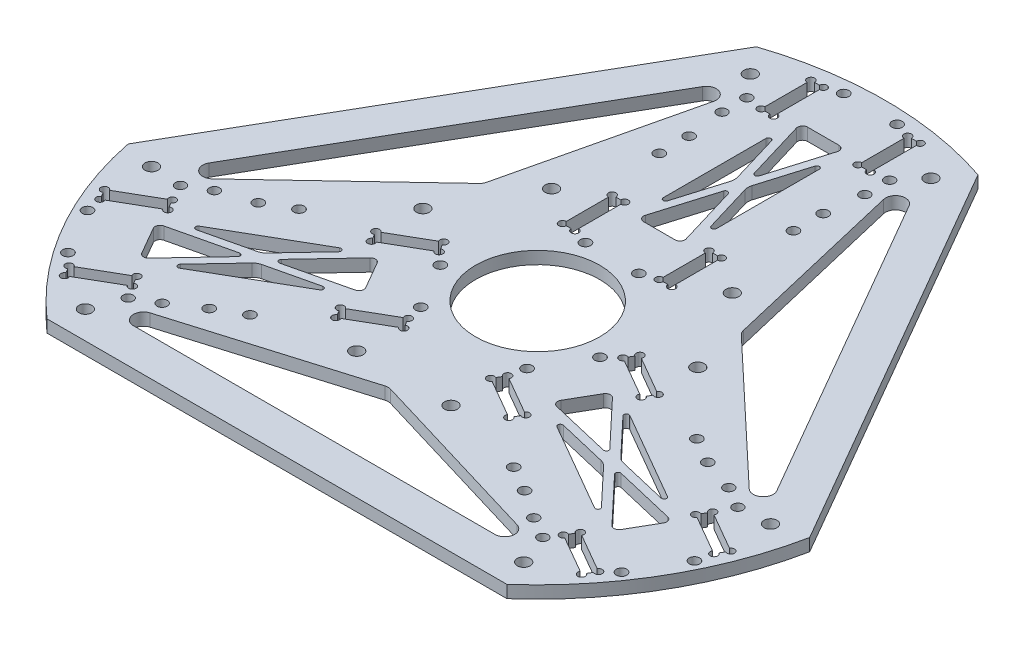
from build123d import *

# Parameters (mm, degrees)
EXTRUDE_1_DEPTH          = 5
SKETCH_2_R               = 2.1
SKETCH_2_R_2             = 2.6
SKETCH_2_W               = 5
SKETCH_2_H               = 20
CUT_EXTRUDE_1_DEPTH      = 10
PATTERN_CIRCULAR_1_COUNT = 3
CUT_EXTRUDE_2_DEPTH      = 10
CUT_EXTRUDE_3_DEPTH      = 10
SKETCH_5_R               = 25
CUT_EXTRUDE_4_DEPTH      = 10
SKETCH_6_R               = 1.5
CUT_EXTRUDE_5_DEPTH      = 229.487776915
CUT_EXTRUDE_6_DEPTH      = 229.487776915
SKETCH_8_R               = 2.05
CUT_EXTRUDE_7_DEPTH      = 10


with BuildPart() as part:
    # 草图1 → 凸台-拉伸1 (new body)
    with BuildSketch(Plane(origin=(0, 0, 0), x_dir=(1, 0, 0), z_dir=(0, 1, 0))):
        with BuildLine():
            Line((-34.641016151, 150), (-147.224318643, -45))
            ThreePointArc((-147.224318643, -45), (-147.224318643, -85), (-112.583302492, -105))
            Line((-112.583302492, -105), (112.583302492, -105))
            ThreePointArc((112.583302492, -105), (147.224318643, -85), (147.224318643, -45))
            Line((147.224318643, -45), (34.641016151, 150))
            ThreePointArc((34.641016151, 150), (0, 170), (-34.641016151, 150))
        make_face()
    extrude(amount=EXTRUDE_1_DEPTH)

    # 草图2 → 切除-拉伸1 (cut)
    with BuildSketch(Plane(origin=(0, 5, 0), x_dir=(1, 0, 0), z_dir=(0, 1, 0))):
        with Locations(Location((-10.75, 30, 0), (0, 0, 270))):
            Circle(SKETCH_2_R)
        with Locations(Location((-10.75, 134, 0), (0, 0, 270))):
            Circle(SKETCH_2_R)
        with Locations(Location((10.75, 30, 0), (0, 0, 270))):
            Circle(SKETCH_2_R)
        with Locations(Location((10.75, 134, 0), (0, 0, 270))):
            Circle(SKETCH_2_R)
        with Locations(Location((-36.38, 42, 0), (0, 0, 270))):
            Circle(SKETCH_2_R_2)
        with Locations(Location((-36.38, 122, 0), (0, 0, 270))):
            Circle(SKETCH_2_R_2)
        with Locations(Location((36.38, 122, 0), (0, 0, 270))):
            Circle(SKETCH_2_R_2)
        with Locations(Location((36.38, 42, 0), (0, 0, 270))):
            Circle(SKETCH_2_R_2)
        with Locations(Location((-27, 88, 0), (0, 0, 270))):
            Circle(SKETCH_2_R)
        with Locations(Location((-27, 76, 0), (0, 0, 270))):
            Circle(SKETCH_2_R)
        with Locations(Location((27, 76, 0), (0, 0, 270))):
            Circle(SKETCH_2_R)
        with Locations(Location((27, 88, 0), (0, 0, 270))):
            Circle(SKETCH_2_R)
        with Locations((-19.5, 42)):
            Rectangle(SKETCH_2_W, SKETCH_2_H)
        with Locations((-19.5, 122)):
            Rectangle(SKETCH_2_W, SKETCH_2_H)
        with Locations((19.5, 42)):
            Rectangle(SKETCH_2_W, SKETCH_2_H)
        with Locations((19.5, 122)):
            Rectangle(SKETCH_2_W, SKETCH_2_H)
    cut_extrude_1 = extrude(amount=-CUT_EXTRUDE_1_DEPTH, mode=Mode.SUBTRACT)

    # 阵列(圆周)1: 切除-拉伸1 ×3 about axis
    pattern_circular_1_axis = Axis((0, 0, 0.914797287), (0, 1, 0))
    for i in range(1, PATTERN_CIRCULAR_1_COUNT):
        add(cut_extrude_1.rotate(pattern_circular_1_axis, i * 360 / PATTERN_CIRCULAR_1_COUNT), mode=Mode.SUBTRACT)

    # 草图3 → 切除-拉伸2 (cut)
    with BuildSketch(Plane(origin=(0, 5, 0), x_dir=(1, 0, 0), z_dir=(0, 1, 0))):
        with BuildLine():
            Line((-72.746257988, -90), (72.746257988, -90))
            ThreePointArc((72.746257988, -90), (76.70385957, -86.580852579), (73.89564953, -82.168694859))
            Line((73.89564953, -82.168694859), (1.149391542, -60.344817463))
            ThreePointArc((1.149391542, -60.344817463), (0, -60.176122604), (-1.149391542, -60.344817463))
            Line((-1.149391542, -60.344817463), (-73.89564953, -82.168694859))
            ThreePointArc((-73.89564953, -82.168694859), (-76.70385957, -86.580852579), (-72.746257988, -90))
        make_face()
        with BuildLine():
            Line((-51.685449138, 31.167811006), (-34.212352379, 105.079857152))
            ThreePointArc((-34.212352379, 105.079857152), (-36.629288029, 109.717917245), (-41.569157347, 108.000107448))
            Line((-41.569157347, 108.000107448), (-114.315415335, -18.000107448))
            ThreePointArc((-114.315415335, -18.000107448), (-113.3331476, -23.137064667), (-108.108001909, -22.911162293))
            Line((-108.108001909, -22.911162293), (-52.834840681, 29.177006457))
            ThreePointArc((-52.834840681, 29.177006457), (-52.114050876, 30.088061302), (-51.685449138, 31.167811006))
        make_face()
        with BuildLine():
            Line((52.834840681, 29.177006457), (108.108001909, -22.911162293))
            ThreePointArc((108.108001909, -22.911162293), (113.3331476, -23.137064667), (114.315415335, -18.000107448))
            Line((114.315415335, -18.000107448), (41.569157347, 108.000107448))
            ThreePointArc((41.569157347, 108.000107448), (36.629288029, 109.717917245), (34.212352379, 105.079857152))
            Line((34.212352379, 105.079857152), (51.685449138, 31.167811006))
            ThreePointArc((51.685449138, 31.167811006), (52.114050876, 30.088061302), (52.834840681, 29.177006457))
        make_face()
    extrude(amount=-CUT_EXTRUDE_2_DEPTH, mode=Mode.SUBTRACT)

    # 草图4 → 切除-拉伸3 (cut)
    with BuildSketch(Plane(origin=(0, 5, 0), x_dir=(1, 0, 0), z_dir=(0, 1, 0))):
        with BuildLine():
            Line((-6.311938698, 115), (6.311938698, 115))
            ThreePointArc((6.311938698, 115), (7.916524555, 114.193861059), (8.227591269, 112.425304229))
            Line((8.227591269, 112.425304229), (0.957826285, 88.192754284))
            ThreePointArc((0.957826285, 88.192754284), (0, 87.48010217), (-0.957826285, 88.192754284))
            Line((-0.957826285, 88.192754284), (-8.227591269, 112.425304229))
            ThreePointArc((-8.227591269, 112.425304229), (-7.916524555, 114.193861059), (-6.311938698, 115))
        make_face()
        with BuildLine():
            Line((8.227591269, 51.574695771), (0.957826285, 75.807245716))
            ThreePointArc((0.957826285, 75.807245716), (0, 76.51989783), (-0.957826285, 75.807245716))
            Line((-0.957826285, 75.807245716), (-8.227591269, 51.574695771))
            ThreePointArc((-8.227591269, 51.574695771), (-7.916524555, 49.806138941), (-6.311938698, 49))
            Line((-6.311938698, 49), (6.311938698, 49))
            ThreePointArc((6.311938698, 49), (7.916524555, 49.806138941), (8.227591269, 51.574695771))
        make_face()
        with BuildLine():
            Line((-10.75, 102.686564497), (-10.75, 61.313435503))
            ThreePointArc((-10.75, 61.313435503), (-9.895213145, 60.324035107), (-8.792173715, 61.026087617))
            Line((-8.792173715, 61.026087617), (-2.931021828, 80.563260572))
            ThreePointArc((-2.931021828, 80.563260572), (-2.720153254, 82), (-2.931021828, 83.436739428))
            Line((-2.931021828, 83.436739428), (-8.792173715, 102.973912383))
            ThreePointArc((-8.792173715, 102.973912383), (-9.895213145, 103.675964893), (-10.75, 102.686564497))
        make_face()
        with BuildLine():
            Line((10.75, 102.686564497), (10.75, 61.313435503))
            ThreePointArc((10.75, 61.313435503), (9.895213145, 60.324035107), (8.792173715, 61.026087617))
            Line((8.792173715, 61.026087617), (2.931021828, 80.563260572))
            ThreePointArc((2.931021828, 80.563260572), (2.720153254, 82), (2.931021828, 83.436739428))
            Line((2.931021828, 83.436739428), (8.792173715, 102.973912383))
            ThreePointArc((8.792173715, 102.973912383), (9.895213145, 103.675964893), (10.75, 102.686564497))
        make_face()
        with BuildLine():
            Line((93.574110908, -43.8727104), (73.723846868, -39.180030352))
            ThreePointArc((73.723846868, -39.180030352), (72.374159738, -38.644278179), (71.235341181, -37.743290924))
            Line((71.235341181, -37.743290924), (57.246229028, -22.898798017))
            ThreePointArc((57.246229028, -22.898798017), (57.189753434, -21.592511595), (58.473992739, -21.346944661))
            Line((58.473992739, -21.346944661), (94.304173482, -42.033509158))
            ThreePointArc((94.304173482, -42.033509158), (94.733625931, -43.268476487), (93.574110908, -43.8727104))
        make_face()
        with BuildLine():
            Line((40.551201096, -32.912650936), (65.172087438, -38.733124753))
            ThreePointArc((65.172087438, -38.733124753), (66.268175416, -38.259948915), (66.129913724, -37.074120963))
            Line((66.129913724, -37.074120963), (48.778792365, -18.662044835))
            ThreePointArc((48.778792365, -18.662044835), (47.091643864, -18.047158096), (45.591214135, -19.03370074))
            Line((45.591214135, -19.03370074), (39.279275436, -29.96629926))
            ThreePointArc((39.279275436, -29.96629926), (39.17511931, -31.758980844), (40.551201096, -32.912650936))
        make_face()
        with BuildLine():
            Line((83.554173482, -60.653055339), (47.723992739, -39.966490842))
            ThreePointArc((47.723992739, -39.966490842), (47.29454029, -38.731523513), (48.454055313, -38.1272896))
            Line((48.454055313, -38.1272896), (68.304319353, -42.819969648))
            ThreePointArc((68.304319353, -42.819969648), (69.654006483, -43.355721821), (70.792825039, -44.256709076))
            Line((70.792825039, -44.256709076), (84.781937193, -59.101201983))
            ThreePointArc((84.781937193, -59.101201983), (84.838412786, -60.407488405), (83.554173482, -60.653055339))
        make_face()
        with BuildLine():
            Line((76.856078782, -43.266875247), (101.476965125, -49.087349064))
            ThreePointArc((101.476965125, -49.087349064), (102.853046911, -50.241019156), (102.748890784, -52.03370074))
            Line((102.748890784, -52.03370074), (96.436952086, -62.96629926))
            ThreePointArc((96.436952086, -62.96629926), (94.936522356, -63.952841904), (93.249373856, -63.337955165))
            Line((93.249373856, -63.337955165), (75.898252497, -44.925879037))
            ThreePointArc((75.898252497, -44.925879037), (75.759990805, -43.740051085), (76.856078782, -43.266875247))
        make_face()
        with BuildLine():
            Line((-84.781937193, -59.101201983), (-70.792825039, -44.256709076))
            ThreePointArc((-70.792825039, -44.256709076), (-69.654006483, -43.355721821), (-68.304319353, -42.819969648))
            Line((-68.304319353, -42.819969648), (-48.454055313, -38.1272896))
            ThreePointArc((-48.454055313, -38.1272896), (-47.29454029, -38.731523513), (-47.723992739, -39.966490842))
            Line((-47.723992739, -39.966490842), (-83.554173482, -60.653055339))
            ThreePointArc((-83.554173482, -60.653055339), (-84.838412786, -60.407488405), (-84.781937193, -59.101201983))
        make_face()
        with BuildLine():
            Line((-48.778792365, -18.662044835), (-66.129913724, -37.074120963))
            ThreePointArc((-66.129913724, -37.074120963), (-66.268175416, -38.259948915), (-65.172087438, -38.733124753))
            Line((-65.172087438, -38.733124753), (-40.551201096, -32.912650936))
            ThreePointArc((-40.551201096, -32.912650936), (-39.17511931, -31.758980844), (-39.279275436, -29.96629926))
            Line((-39.279275436, -29.96629926), (-45.591214135, -19.03370074))
            ThreePointArc((-45.591214135, -19.03370074), (-47.091643864, -18.047158096), (-48.778792365, -18.662044835))
        make_face()
        with BuildLine():
            Line((-94.304173482, -42.033509158), (-58.473992739, -21.346944661))
            ThreePointArc((-58.473992739, -21.346944661), (-57.189753434, -21.592511595), (-57.246229028, -22.898798017))
            Line((-57.246229028, -22.898798017), (-71.235341181, -37.743290924))
            ThreePointArc((-71.235341181, -37.743290924), (-72.374159738, -38.644278179), (-73.723846868, -39.180030352))
            Line((-73.723846868, -39.180030352), (-93.574110908, -43.8727104))
            ThreePointArc((-93.574110908, -43.8727104), (-94.733625931, -43.268476487), (-94.304173482, -42.033509158))
        make_face()
        with BuildLine():
            Line((-75.898252497, -44.925879037), (-93.249373856, -63.337955165))
            ThreePointArc((-93.249373856, -63.337955165), (-94.936522356, -63.952841904), (-96.436952086, -62.96629926))
            Line((-96.436952086, -62.96629926), (-102.748890784, -52.03370074))
            ThreePointArc((-102.748890784, -52.03370074), (-102.853046911, -50.241019156), (-101.476965125, -49.087349064))
            Line((-101.476965125, -49.087349064), (-76.856078782, -43.266875247))
            ThreePointArc((-76.856078782, -43.266875247), (-75.759990805, -43.740051085), (-75.898252497, -44.925879037))
        make_face()
    extrude(amount=-CUT_EXTRUDE_3_DEPTH, mode=Mode.SUBTRACT)

    # 草图5 → 切除-拉伸4 (cut)
    with BuildSketch(Plane.XZ):
        with Locations(Location((0, 0, 0), (0, 0, 270))):
            Circle(SKETCH_5_R)
    extrude(amount=-CUT_EXTRUDE_4_DEPTH, mode=Mode.SUBTRACT)

    # 草图6 → 切除-拉伸5 (cut, through all)
    with BuildSketch(Plane(origin=(0, 5, 0), x_dir=(1, 0, 0), z_dir=(0, 1, 0))):
        with Locations((-17, 132)):
            Circle(SKETCH_6_R)
        with Locations((-22, 132)):
            Circle(SKETCH_6_R)
        with Locations((-22, 112)):
            Circle(SKETCH_6_R)
        with Locations((-17, 112)):
            Circle(SKETCH_6_R)
        with Locations((22, 132)):
            Circle(SKETCH_6_R)
        with Locations((17, 132)):
            Circle(SKETCH_6_R)
        with Locations((17, 112)):
            Circle(SKETCH_6_R)
        with Locations((22, 112)):
            Circle(SKETCH_6_R)
        with Locations((17, 32)):
            Circle(SKETCH_6_R)
        with Locations((22, 32)):
            Circle(SKETCH_6_R)
        with Locations((22, 52)):
            Circle(SKETCH_6_R)
        with Locations((17, 52)):
            Circle(SKETCH_6_R)
        with Locations((-17, 32)):
            Circle(SKETCH_6_R)
        with Locations((-22, 32)):
            Circle(SKETCH_6_R)
        with Locations((-17, 52)):
            Circle(SKETCH_6_R)
        with Locations((-22, 52)):
            Circle(SKETCH_6_R)
        with Locations((37.005050611, -2.649764067)):
            Circle(SKETCH_6_R)
        with Locations((39.505050611, 1.680362952)):
            Circle(SKETCH_6_R)
        with Locations((54.325558687, -12.649764067)):
            Circle(SKETCH_6_R)
        with Locations((56.825558687, -8.319637048)):
            Circle(SKETCH_6_R)
        with Locations((34.825558687, -46.424754814)):
            Circle(SKETCH_6_R)
        with Locations((17.505050611, -36.424754814)):
            Circle(SKETCH_6_R)
        with Locations((20.005050611, -32.094627795)):
            Circle(SKETCH_6_R)
        with Locations((37.325558687, -42.094627795)):
            Circle(SKETCH_6_R)
        with Locations((108.787082914, -38.319637048)):
            Circle(SKETCH_6_R)
        with Locations((106.287082914, -42.649764067)):
            Circle(SKETCH_6_R)
        with Locations((86.787082914, -76.424754814)):
            Circle(SKETCH_6_R)
        with Locations((89.287082914, -72.094627795)):
            Circle(SKETCH_6_R)
        with Locations((104.10759099, -86.424754814)):
            Circle(SKETCH_6_R)
        with Locations((106.60759099, -82.094627795)):
            Circle(SKETCH_6_R)
        with Locations((123.60759099, -52.649764067)):
            Circle(SKETCH_6_R)
        with Locations((126.10759099, -48.319637048)):
            Circle(SKETCH_6_R)
        with Locations((-20.005050611, -32.094627795)):
            Circle(SKETCH_6_R)
        with Locations((-17.505050611, -36.424754814)):
            Circle(SKETCH_6_R)
        with Locations((-37.325558687, -42.094627795)):
            Circle(SKETCH_6_R)
        with Locations((-34.825558687, -46.424754814)):
            Circle(SKETCH_6_R)
        with Locations((-56.825558687, -8.319637048)):
            Circle(SKETCH_6_R)
        with Locations((-39.505050611, 1.680362952)):
            Circle(SKETCH_6_R)
        with Locations((-37.005050611, -2.649764067)):
            Circle(SKETCH_6_R)
        with Locations((-54.325558687, -12.649764067)):
            Circle(SKETCH_6_R)
        with Locations((-86.787082914, -76.424754814)):
            Circle(SKETCH_6_R)
        with Locations((-89.287082914, -72.094627795)):
            Circle(SKETCH_6_R)
        with Locations((-108.787082914, -38.319637048)):
            Circle(SKETCH_6_R)
        with Locations((-106.287082914, -42.649764067)):
            Circle(SKETCH_6_R)
        with Locations((-126.10759099, -48.319637048)):
            Circle(SKETCH_6_R)
        with Locations((-123.60759099, -52.649764067)):
            Circle(SKETCH_6_R)
        with Locations((-106.60759099, -82.094627795)):
            Circle(SKETCH_6_R)
        with Locations((-104.10759099, -86.424754814)):
            Circle(SKETCH_6_R)
    extrude(amount=-CUT_EXTRUDE_5_DEPTH, mode=Mode.SUBTRACT)

    # 草图7 → 切除-拉伸6 (cut, through all)
    with BuildSketch(Plane(origin=(0, 5, 0), x_dir=(1, 0, 0), z_dir=(0, 1, 0))):
        with BuildLine():
            Line((0, 209.701011039), (-104.230661533, 93.46640678))
            ThreePointArc((-104.230661533, 93.46640678), (0, 140), (104.230661533, 93.46640678))
            Line((104.230661533, 93.46640678), (0, 209.701011039))
        make_face()
        with BuildLine():
            ThreePointArc((-73.519672302, -119.142174668), (-130.347749314, -51.08291543), (-134.893788955, 37.46552684))
            Line((-134.893788955, 37.46552684), (-181.092059989, -128.870311692))
            Line((-181.092059989, -128.870311692), (-73.519672302, -119.142174668))
        make_face()
        with BuildLine():
            ThreePointArc((140, 0), (103.684764947, -94.071619088), (13.579006888, -139.339910191))
            Line((13.579006888, -139.339910191), (224.516699202, -118.783528512))
            Line((224.516699202, -118.783528512), (140, 0))
        make_face()
    extrude(amount=-CUT_EXTRUDE_6_DEPTH, mode=Mode.SUBTRACT)

    # 草图8 → 切除-拉伸7 (cut)
    with BuildSketch(Plane(origin=(0, 5, 0), x_dir=(1, 0, 0), z_dir=(0, 1, 0))):
        with Locations(Location((-28.75, 103, 0), (0, 0, 270))):
            Circle(SKETCH_8_R)
        with Locations(Location((-28.75, 113, 0), (0, 0, 270))):
            Circle(SKETCH_8_R)
        with Locations(Location((28.75, 103, 0), (0, 0, 270))):
            Circle(SKETCH_8_R)
        with Locations(Location((28.75, 113, 0), (0, 0, 270))):
            Circle(SKETCH_8_R)
        with Locations(Location((112.235870628, -31.601769641, 0), (0, 0, 270))):
            Circle(SKETCH_8_R)
        with Locations(Location((103.57561659, -26.601769641, 0), (0, 0, 270))):
            Circle(SKETCH_8_R)
        with Locations(Location((83.485870628, -81.398230359, 0), (0, 0, 270))):
            Circle(SKETCH_8_R)
        with Locations(Location((74.82561659, -76.398230359, 0), (0, 0, 270))):
            Circle(SKETCH_8_R)
        with Locations(Location((-83.485870628, -81.398230359, 0), (0, 0, 270))):
            Circle(SKETCH_8_R)
        with Locations(Location((-74.82561659, -76.398230359, 0), (0, 0, 270))):
            Circle(SKETCH_8_R)
        with Locations(Location((-112.235870628, -31.601769641, 0), (0, 0, 270))):
            Circle(SKETCH_8_R)
        with Locations(Location((-103.57561659, -26.601769641, 0), (0, 0, 270))):
            Circle(SKETCH_8_R)
    extrude(amount=-CUT_EXTRUDE_7_DEPTH, mode=Mode.SUBTRACT)


solid = part.part
